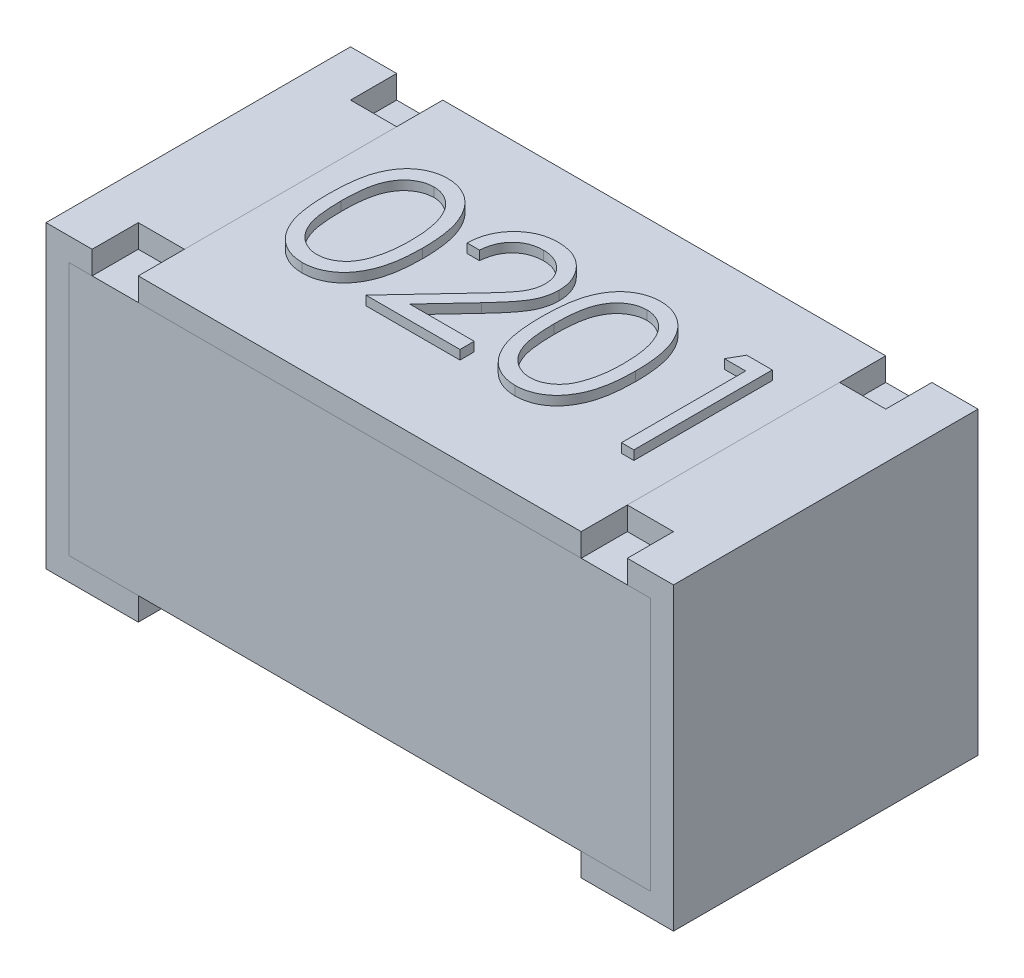
from build123d import *

# Parameters (mm, degrees)
CROQUIS1_W          = 0.63
CROQUIS1_H          = 0.33
EXTRUIR1_DEPTH      = 0.3
CROQUIS2_W          = 0.63
CROQUIS2_H          = 0.025
EXTRUIR2_DEPTH      = 1.546008242
CROQUIS4_W          = 0.33
CROQUIS4_H          = 0.025
EXTRUIR3_DEPTH      = 0.48
CROQUIS5_W          = 0.05
CROQUIS5_H          = 0.05
EXTRUIR4_DEPTH      = 0.025
BOSS_EXTRUDE1_DEPTH = 0.01


with BuildPart() as part:
    # Croquis1 → Extruir1 (new body)
    with BuildSketch(Plane(origin=(0, 0, 0), x_dir=(1, 0, 0), z_dir=(0, 1, 0))):
        Rectangle(CROQUIS1_W, CROQUIS1_H)
    extrude(amount=EXTRUIR1_DEPTH)

    # Croquis2 → Extruir2 (cut, through all)
    with BuildSketch(Plane.XY.offset(0.165)):
        with Locations((0, 0.0125)):
            Rectangle(CROQUIS2_W, CROQUIS2_H)
    extrude(amount=-EXTRUIR2_DEPTH, mode=Mode.SUBTRACT)


with BuildPart() as body_2:
    # Barrer1: sweep along a path in Croquis3
    with BuildLine(Plane.XY.offset(0.165)) as barrer1_path:
        Line((-0.24, 0.325), (-0.34, 0.325))
        Line((-0.34, 0.325), (-0.34, 0))
        Line((-0.34, 0), (-0.24, 0))
    # Croquis3D1 → Barrer1 (sweep)
    with BuildSketch(Plane(origin=(-0.24, 0.325, 0.165), x_dir=(0, -0.07554111272939004, -0.99714268802795), z_dir=(-1, 0, 0))):
        Polygon((0, 0), (0.329057087, -0.024928567), (0.330945615, 0), (0.001888528, 0.024928567), align=None)
    sweep(path=barrer1_path.line, transition=Transition.RIGHT)


with BuildPart() as body_3:
    # Simetría1: mirrored copy
    add(body_2.part.mirror(Plane(origin=(0, 0.3, 0.165), x_dir=(0, 0, 1), z_dir=(1, 0, 0))))


with BuildPart() as body_4:
    # Croquis4 → Extruir3 (new body)
    with BuildSketch(Plane(origin=(-0.24, 0, 0), x_dir=(0, 0, -1), z_dir=(1, 0, 0))):
        with Locations((0, 0.3125)):
            Rectangle(CROQUIS4_W, CROQUIS4_H)
    extrude(amount=EXTRUIR3_DEPTH)

    # Sketch1 → Boss-Extrude1 (add)
    # profile 1 of 4: a face of its own
    with BuildSketch(Plane(origin=(0, 0.325, 0), x_dir=(1, 0, 0), z_dir=(0, 1, 0))):
        with BuildLine():
            add(Edge.make_bspline(
                [(-0.203961996, 0.005221836), (-0.203947938, 0.007626009), (-0.20392063, 0.012296151), (-0.203616841, 0.019101208), (-0.203112183, 0.02548522), (-0.202420581, 0.031448494), (-0.201578954, 0.03699257), (-0.200455433, 0.042102631), (-0.199177741, 0.046802328), (-0.197696922, 0.051106987), (-0.196026017, 0.055074603), (-0.194207406, 0.058778541), (-0.192168915, 0.062213195), (-0.190027047, 0.065433386), (-0.187695101, 0.068386401), (-0.185239439, 0.071113944), (-0.182564215, 0.073552976), (-0.179760372, 0.07577496), (-0.176802524, 0.077722795), (-0.173774981, 0.079438484), (-0.170656905, 0.080904192), (-0.167439783, 0.08205664), (-0.16415253, 0.083008533), (-0.160783656, 0.083659488), (-0.157327597, 0.08406907), (-0.154994822, 0.084108227), (-0.153811755, 0.084128086)],
                knots=[0, 0, 0, 0, 1.646270934, 3.197905019, 4.663502075, 6.030701355, 7.308322542, 8.50163776, 9.611534131, 10.641858119, 11.616356847, 12.558055219, 13.465016945, 14.349605745, 15.204443733, 16.039544428, 16.859896111, 17.680448484, 18.487036065, 19.28249412, 20.06191084, 20.843045899, 21.620316918, 22.403196591, 23.190181807, 24, 24, 24, 24], degree=3))
            add(Edge.make_bspline(
                [(-0.153811755, 0.084128086), (-0.152618806, 0.084107179), (-0.150246406, 0.084065603), (-0.146738961, 0.083666005), (-0.143312546, 0.083002957), (-0.139981769, 0.082063487), (-0.13671927, 0.080897958), (-0.133550566, 0.079437081), (-0.130455977, 0.077736559), (-0.127484679, 0.075738392), (-0.124604053, 0.073510581), (-0.121884854, 0.070992181), (-0.119326836, 0.068208621), (-0.116897895, 0.065189684), (-0.114666941, 0.061877466), (-0.112542365, 0.058329576), (-0.110640706, 0.054483967), (-0.10880922, 0.050404804), (-0.107228349, 0.045979219), (-0.105802653, 0.041232158), (-0.104650697, 0.03610755), (-0.103691157, 0.030632282), (-0.102947804, 0.024786247), (-0.102406405, 0.018581976), (-0.102120416, 0.012015388), (-0.102066557, 0.007525766), (-0.102038919, 0.005221836)],
                knots=[0, 0, 0, 0, 0.810914788, 1.612654377, 2.396697861, 3.181598691, 3.963628158, 4.749916497, 5.551656086, 6.361998678, 7.18212741, 8.025565596, 8.878627764, 9.750805457, 10.657531673, 11.591944965, 12.560506719, 13.57287815, 14.630710178, 15.753379473, 16.941251878, 18.199788006, 19.531962791, 20.947069417, 22.433333509, 24, 24, 24, 24], degree=3))
            add(Edge.make_bspline(
                [(-0.102038919, 0.005221836), (-0.102066844, 0.002927954), (-0.102121255, -0.001541581), (-0.102403199, -0.008078623), (-0.102958569, -0.014249968), (-0.103653283, -0.020070416), (-0.104615467, -0.025515743), (-0.105798546, -0.030604791), (-0.107112131, -0.035359536), (-0.108733622, -0.039741028), (-0.110508367, -0.043810388), (-0.112439304, -0.047610409), (-0.114508011, -0.051174678), (-0.116761814, -0.054474667), (-0.119164103, -0.057533753), (-0.121766294, -0.060297937), (-0.124495033, -0.062833823), (-0.127384137, -0.065090321), (-0.130401775, -0.067065384), (-0.133485735, -0.068831692), (-0.136690737, -0.07025595), (-0.13994415, -0.07147888), (-0.143292508, -0.072413186), (-0.146731639, -0.073059208), (-0.150244049, -0.073512287), (-0.152618402, -0.073546851), (-0.153811755, -0.073564222)],
                knots=[0, 0, 0, 0, 1.561518951, 3.042555995, 4.452378317, 5.7783523, 7.031515105, 8.214008947, 9.334062868, 10.386615937, 11.391082383, 12.354592575, 13.286541444, 14.194233754, 15.072674879, 15.931287219, 16.775624067, 17.606195743, 18.42308326, 19.229000347, 20.022332153, 20.807536673, 21.593273796, 22.3848459, 23.188221202, 24, 24, 24, 24], degree=3))
            add(Edge.make_bspline(
                [(-0.153811755, -0.073564222), (-0.154994789, -0.073544236), (-0.1573275, -0.073504826), (-0.160784032, -0.073097094), (-0.164138994, -0.072441573), (-0.167408941, -0.071523718), (-0.170610649, -0.070400225), (-0.17370049, -0.068936496), (-0.176712819, -0.06725075), (-0.1796396, -0.065330946), (-0.182425835, -0.063131446), (-0.185087204, -0.060698691), (-0.187556848, -0.057971973), (-0.189855452, -0.054994348), (-0.192040056, -0.051793209), (-0.1940496, -0.04832485), (-0.195908351, -0.044603024), (-0.197607358, -0.040603685), (-0.199113729, -0.036268473), (-0.200444345, -0.031547794), (-0.201494952, -0.026399981), (-0.202394221, -0.02086638), (-0.203119552, -0.014923212), (-0.203614737, -0.00856725), (-0.203920794, -0.001802455), (-0.203948011, 0.002837678), (-0.203961996, 0.005221836)],
                knots=[0, 0, 0, 0, 0.810891512, 1.598919785, 2.382837074, 3.152667961, 3.926044502, 4.706494248, 5.493654104, 6.291793342, 7.103789334, 7.925228297, 8.761435821, 9.622817696, 10.50288917, 11.416980706, 12.369136599, 13.353924996, 14.394355917, 15.514179734, 16.714354668, 17.994756427, 19.357759367, 20.818452758, 22.365282078, 24, 24, 24, 24], degree=3))
        make_face()
        with BuildLine():
            add(Edge.make_bspline(
                [(-0.190500457, 0.005281932), (-0.190495338, 0.003278416), (-0.190485403, -0.000610015), (-0.190225851, -0.00626044), (-0.18987227, -0.011530597), (-0.189416214, -0.016427177), (-0.188738945, -0.020933606), (-0.187980083, -0.025080878), (-0.187056593, -0.028847046), (-0.18596395, -0.032257952), (-0.184719417, -0.035371483), (-0.183360594, -0.038268678), (-0.181900849, -0.040983761), (-0.180267171, -0.043492344), (-0.178487954, -0.045802609), (-0.176603386, -0.047955444), (-0.174543132, -0.049875315), (-0.171692972, -0.052177894), (-0.167930266, -0.054557286), (-0.163189389, -0.056629261), (-0.158317884, -0.057931366), (-0.155011402, -0.058096956), (-0.153361034, -0.058179607)],
                knots=[0, 0, 0, 0, 1.459021318, 2.831673884, 4.118529203, 5.306027144, 6.411944654, 7.436330062, 8.375795394, 9.233974572, 10.042671642, 10.816086306, 11.563610507, 12.285937304, 12.993564865, 13.685989202, 14.367179055, 15.041617293, 16.353048772, 17.594441528, 18.799311195, 20, 20, 20, 20], degree=3))
            add(Edge.make_bspline(
                [(-0.153361034, -0.058179607), (-0.151699991, -0.05811113), (-0.148381334, -0.057974319), (-0.143532743, -0.056654373), (-0.138825732, -0.054662822), (-0.135136934, -0.052307929), (-0.132330539, -0.050065286), (-0.130319811, -0.04815323), (-0.128474295, -0.046012264), (-0.12672392, -0.043702294), (-0.125118531, -0.041179187), (-0.123658683, -0.038455077), (-0.122326539, -0.035522398), (-0.12156758, -0.033475124), (-0.121179544, -0.032428405)],
                knots=[0, 0, 0, 0, 1.353760809, 2.704726607, 4.075137775, 5.516104923, 6.260822281, 7.007110065, 7.778089737, 8.566572457, 9.372053459, 10.217411131, 11.088608312, 12, 12, 12, 12], degree=3))
            add(Edge.make_bspline(
                [(-0.121179544, -0.032428405), (-0.120727325, -0.031089987), (-0.119809127, -0.028372426), (-0.118625766, -0.024156841), (-0.11769382, -0.019733865), (-0.11685539, -0.015129932), (-0.116283116, -0.010311088), (-0.115822496, -0.005292243), (-0.115551181, -6.9613e-05), (-0.115517548, 0.003478744), (-0.115500457, 0.005281932)],
                knots=[0, 0, 0, 0, 0.884706709, 1.796334032, 2.740027952, 3.714592787, 4.726048262, 5.777819803, 6.87074269, 8, 8, 8, 8], degree=3))
            add(Edge.make_bspline(
                [(-0.115500457, 0.005281932), (-0.115524037, 0.007084828), (-0.115570163, 0.010611678), (-0.115746477, 0.015776742), (-0.116201773, 0.020682504), (-0.11670745, 0.025350095), (-0.117453045, 0.02975368), (-0.118256951, 0.033930121), (-0.119337003, 0.03782768), (-0.120490708, 0.041507376), (-0.121811153, 0.044927404), (-0.123264685, 0.048103709), (-0.124817046, 0.051051626), (-0.126503142, 0.053763066), (-0.128302957, 0.056250175), (-0.130263994, 0.058463086), (-0.132308468, 0.060470385), (-0.135172061, 0.062761638), (-0.138920959, 0.065097854), (-0.143585773, 0.067247815), (-0.148440229, 0.068482456), (-0.151721949, 0.068656528), (-0.153361034, 0.06874347)],
                knots=[0, 0, 0, 0, 1.31362396, 2.569729283, 3.763502607, 4.902122613, 5.988968491, 7.01645872, 7.998833611, 8.933434873, 9.825090667, 10.667526885, 11.477055099, 12.250526234, 12.991942729, 13.710640831, 14.402115721, 15.076753259, 16.378508321, 17.609869233, 18.806226677, 20, 20, 20, 20], degree=3))
            add(Edge.make_bspline(
                [(-0.153361034, 0.06874347), (-0.15502006, 0.068656408), (-0.158341133, 0.068482126), (-0.163246045, 0.067252415), (-0.16794766, 0.065109002), (-0.171686645, 0.0627539), (-0.174552236, 0.06051083), (-0.176570065, 0.058565696), (-0.178462044, 0.056437999), (-0.180204946, 0.054106489), (-0.181837343, 0.05160083), (-0.18333653, 0.048901312), (-0.184687272, 0.045994253), (-0.185933752, 0.04288212), (-0.187029729, 0.039471508), (-0.187933756, 0.03570998), (-0.188768916, 0.031575899), (-0.189360141, 0.027045063), (-0.189885731, 0.022147256), (-0.190223503, 0.016863943), (-0.190486271, 0.011204041), (-0.190495634, 0.007295505), (-0.190500457, 0.005281932)],
                knots=[0, 0, 0, 0, 1.207732386, 2.417664972, 3.655092373, 4.956220595, 5.625982001, 6.301752483, 6.994047911, 7.697131622, 8.419323945, 9.170223765, 9.943494443, 10.752040957, 11.610060368, 12.549350801, 13.567764191, 14.679664412, 15.874934091, 17.154273443, 18.533957287, 20, 20, 20, 20], degree=3))
        make_face(mode=Mode.SUBTRACT)
    # profile 2 of 4: a face of its own
    with BuildSketch(Plane(origin=(0, 0.325, 0), x_dir=(1, 0, 0), z_dir=(0, 1, 0))):
        with BuildLine():
            Line((-0.069346611, 0.034128086), (-0.08280815, 0.034128086))
            add(Edge.make_bspline(
                [(-0.08280815, 0.034128086), (-0.082720414, 0.035913981), (-0.082548105, 0.039421431), (-0.081741178, 0.044535313), (-0.080586569, 0.049423376), (-0.078954078, 0.054046372), (-0.076926667, 0.058445178), (-0.07449538, 0.062602322), (-0.071615643, 0.066501944), (-0.06834964, 0.070107894), (-0.064802413, 0.073415933), (-0.060975015, 0.076272586), (-0.056953086, 0.078686201), (-0.052748826, 0.080703968), (-0.048314802, 0.082218533), (-0.043691251, 0.083342318), (-0.038857859, 0.084018447), (-0.035564715, 0.084091124), (-0.03388988, 0.084128086)],
                knots=[0, 0, 0, 0, 1.10065271, 2.161652631, 3.183658789, 4.190468796, 5.17591951, 6.163126047, 7.15150782, 8.156236427, 9.156009102, 10.134482811, 11.092018607, 12.041330605, 13.001268258, 13.972401359, 14.968799086, 16, 16, 16, 16], degree=3))
            add(Edge.make_bspline(
                [(-0.03388988, 0.084128086), (-0.032245106, 0.08408958), (-0.029013182, 0.084013919), (-0.024296239, 0.08336416), (-0.019805783, 0.082346492), (-0.015550593, 0.080918689), (-0.011564619, 0.078999356), (-0.007817917, 0.076693747), (-0.004265883, 0.074027183), (-0.001068449, 0.070887734), (0.001867612, 0.067536203), (0.004400565, 0.06395815), (0.006569701, 0.060262609), (0.008377744, 0.056421401), (0.009708722, 0.052398357), (0.010719216, 0.048252048), (0.011290391, 0.043939556), (0.011378052, 0.041020704), (0.01142262, 0.039536739)],
                knots=[0, 0, 0, 0, 1.111607364, 2.184268762, 3.212621178, 4.221274766, 5.211760367, 6.196651075, 7.1921475, 8.207485113, 9.220403448, 10.201281604, 11.166441695, 12.114753415, 13.065576456, 14.026450734, 14.996634279, 16, 16, 16, 16], degree=3))
            add(Edge.make_bspline(
                [(0.01142262, 0.039536739), (0.011350051, 0.037447546), (0.011206188, 0.033305823), (0.009975572, 0.027219472), (0.008053578, 0.021322611), (0.005739406, 0.016576727), (0.003404873, 0.012752434), (0.001301122, 0.009603775), (-0.001161655, 0.006213541), (-0.004019305, 0.002593083), (-0.007212714, -0.001285955), (-0.010770807, -0.005421232), (-0.014718956, -0.009770022), (-0.017490035, -0.012740262), (-0.018925938, -0.014279366)],
                knots=[0, 0, 0, 0, 1.184426356, 2.348067706, 3.509069118, 4.696110526, 5.333549288, 6.050745305, 6.844228056, 7.710549037, 8.667450064, 9.695053472, 10.805634456, 12, 12, 12, 12], degree=3))
            Line((-0.018925938, -0.014279366), (-0.056455986, -0.054333453))
            Line((-0.056455986, -0.054333453), (0.013345697, -0.054333453))
            Line((0.013345697, -0.054333453), (0.013345697, -0.069718068))
            Line((0.013345697, -0.069718068), (-0.08857738, -0.069718068))
            Line((-0.08857738, -0.069718068), (-0.030404303, -0.007638741))
            add(Edge.make_bspline(
                [(-0.030404303, -0.007638741), (-0.028987965, -0.006160243), (-0.02626747, -0.003320349), (-0.022419645, 0.000825778), (-0.018963689, 0.004672187), (-0.015877229, 0.00821161), (-0.013227222, 0.01149582), (-0.010875554, 0.014418451), (-0.008991315, 0.017107927), (-0.006946369, 0.020225382), (-0.00496577, 0.024031624), (-0.003263812, 0.028683068), (-0.002226033, 0.033471379), (-0.00210154, 0.03670718), (-0.002038919, 0.038334816)],
                knots=[0, 0, 0, 0, 1.329631726, 2.553950428, 3.673215718, 4.687767853, 5.603093632, 6.413772471, 7.123043292, 7.734684054, 8.834405432, 9.900288307, 10.943827018, 12, 12, 12, 12], degree=3))
            add(Edge.make_bspline(
                [(-0.002038919, 0.038334816), (-0.002066165, 0.039358305), (-0.002119862, 0.041375404), (-0.002593763, 0.044332794), (-0.003309928, 0.047185571), (-0.004336153, 0.049942512), (-0.005690728, 0.052575897), (-0.007339587, 0.055088932), (-0.009242018, 0.057518459), (-0.011442787, 0.059796458), (-0.013860423, 0.061882795), (-0.016414462, 0.06373097), (-0.01911661, 0.065275504), (-0.021955472, 0.066541653), (-0.024923135, 0.067534884), (-0.028025339, 0.068223109), (-0.031253511, 0.068655215), (-0.033457803, 0.06871368), (-0.034580986, 0.06874347)],
                knots=[0, 0, 0, 0, 0.991446411, 1.95395049, 2.89581595, 3.838931463, 4.798493298, 5.75982156, 6.748411868, 7.785213223, 8.824556874, 9.840280684, 10.836137867, 11.835679398, 12.848801643, 13.863922112, 14.911575587, 16, 16, 16, 16], degree=3))
            add(Edge.make_bspline(
                [(-0.034580986, 0.06874347), (-0.035754022, 0.068712826), (-0.03805767, 0.068652646), (-0.041439914, 0.068231674), (-0.044666448, 0.067505424), (-0.047745387, 0.066512138), (-0.05068194, 0.065249629), (-0.053461828, 0.063677125), (-0.056078809, 0.06180069), (-0.058537803, 0.059673238), (-0.060803402, 0.057304626), (-0.062793982, 0.054664199), (-0.064533297, 0.051800167), (-0.066050836, 0.048720258), (-0.067283222, 0.045396524), (-0.068224929, 0.041840765), (-0.068970079, 0.038068421), (-0.069219016, 0.035463346), (-0.069346611, 0.034128086)],
                knots=[0, 0, 0, 0, 1.031018746, 2.02475058, 2.990194455, 3.934040569, 4.864654155, 5.795059489, 6.735614925, 7.690564532, 8.649604399, 9.611025574, 10.590972636, 11.591080095, 12.624614302, 13.701020113, 14.821632451, 16, 16, 16, 16], degree=3))
        make_face()
    # profile 3 of 4: a face of its own
    with BuildSketch(Plane(origin=(0, 0.325, 0), x_dir=(1, 0, 0), z_dir=(0, 1, 0))):
        with BuildLine():
            add(Edge.make_bspline(
                [(0.026807235, 0.005221836), (0.026821293, 0.007626009), (0.026848601, 0.012296151), (0.02715239, 0.019101208), (0.027657048, 0.02548522), (0.028348649, 0.031448494), (0.029190277, 0.03699257), (0.030313798, 0.042102631), (0.031591489, 0.046802328), (0.033072309, 0.051106987), (0.034743214, 0.055074603), (0.036561825, 0.058778541), (0.038600316, 0.062213195), (0.040742184, 0.065433386), (0.04307413, 0.068386401), (0.045529792, 0.071113944), (0.048205016, 0.073552976), (0.051008859, 0.07577496), (0.053966707, 0.077722795), (0.05699425, 0.079438484), (0.060112326, 0.080904192), (0.063329448, 0.08205664), (0.066616701, 0.083008533), (0.069985575, 0.083659488), (0.073441633, 0.08406907), (0.075774409, 0.084108227), (0.076957475, 0.084128086)],
                knots=[0, 0, 0, 0, 1.646270934, 3.197905019, 4.663502075, 6.030701355, 7.308322542, 8.50163776, 9.611534131, 10.641858119, 11.616356847, 12.558055219, 13.465016945, 14.349605745, 15.204443733, 16.039544428, 16.859896111, 17.680448484, 18.487036065, 19.28249412, 20.06191084, 20.843045899, 21.620316918, 22.403196591, 23.190181807, 24, 24, 24, 24], degree=3))
            add(Edge.make_bspline(
                [(0.076957475, 0.084128086), (0.078150424, 0.084107179), (0.080522825, 0.084065603), (0.08403027, 0.083666005), (0.087456684, 0.083002957), (0.090787462, 0.082063487), (0.094049961, 0.080897958), (0.097218664, 0.079437081), (0.100313254, 0.077736559), (0.103284552, 0.075738392), (0.106165178, 0.073510581), (0.108884376, 0.070992181), (0.111442394, 0.068208621), (0.113871336, 0.065189684), (0.11610229, 0.061877466), (0.118226866, 0.058329576), (0.120128525, 0.054483967), (0.121960011, 0.050404804), (0.123540882, 0.045979219), (0.124966578, 0.041232158), (0.126118534, 0.03610755), (0.127078074, 0.030632282), (0.127821426, 0.024786247), (0.128362825, 0.018581976), (0.128648815, 0.012015388), (0.128702673, 0.007525766), (0.128730312, 0.005221836)],
                knots=[0, 0, 0, 0, 0.810914788, 1.612654377, 2.396697861, 3.181598691, 3.963628158, 4.749916497, 5.551656086, 6.361998678, 7.18212741, 8.025565596, 8.878627764, 9.750805457, 10.657531673, 11.591944965, 12.560506719, 13.57287815, 14.630710178, 15.753379473, 16.941251878, 18.199788006, 19.531962791, 20.947069417, 22.433333509, 24, 24, 24, 24], degree=3))
            add(Edge.make_bspline(
                [(0.128730312, 0.005221836), (0.128702387, 0.002927954), (0.128647976, -0.001541581), (0.128366031, -0.008078623), (0.127810662, -0.014249968), (0.127115948, -0.020070416), (0.126153764, -0.025515743), (0.124970685, -0.030604791), (0.1236571, -0.035359536), (0.122035609, -0.039741028), (0.120260864, -0.043810388), (0.118329927, -0.047610409), (0.11626122, -0.051174678), (0.114007417, -0.054474667), (0.111605128, -0.057533753), (0.109002937, -0.060297937), (0.106274197, -0.062833823), (0.103385094, -0.065090321), (0.100367456, -0.067065384), (0.097283495, -0.068831692), (0.094078493, -0.07025595), (0.090825081, -0.07147888), (0.087476723, -0.072413186), (0.084037591, -0.073059208), (0.080525181, -0.073512287), (0.078150829, -0.073546851), (0.076957475, -0.073564222)],
                knots=[0, 0, 0, 0, 1.561518951, 3.042555995, 4.452378317, 5.7783523, 7.031515105, 8.214008947, 9.334062868, 10.386615937, 11.391082383, 12.354592575, 13.286541444, 14.194233754, 15.072674879, 15.931287219, 16.775624067, 17.606195743, 18.42308326, 19.229000347, 20.022332153, 20.807536673, 21.593273796, 22.3848459, 23.188221202, 24, 24, 24, 24], degree=3))
            add(Edge.make_bspline(
                [(0.076957475, -0.073564222), (0.075774442, -0.073544236), (0.073441731, -0.073504826), (0.069985198, -0.073097094), (0.066630237, -0.072441573), (0.06336029, -0.071523718), (0.060158582, -0.070400225), (0.057068741, -0.068936496), (0.054056412, -0.06725075), (0.051129631, -0.065330946), (0.048343396, -0.063131446), (0.045682027, -0.060698691), (0.043212383, -0.057971973), (0.040913779, -0.054994348), (0.038729175, -0.051793209), (0.036719631, -0.04832485), (0.03486088, -0.044603024), (0.033161873, -0.040603685), (0.031655502, -0.036268473), (0.030324886, -0.031547794), (0.029274279, -0.026399981), (0.028375009, -0.02086638), (0.027649679, -0.014923212), (0.027154493, -0.00856725), (0.026848437, -0.001802455), (0.02682122, 0.002837678), (0.026807235, 0.005221836)],
                knots=[0, 0, 0, 0, 0.810891512, 1.598919785, 2.382837074, 3.152667961, 3.926044502, 4.706494248, 5.493654104, 6.291793342, 7.103789334, 7.925228297, 8.761435821, 9.622817696, 10.50288917, 11.416980706, 12.369136599, 13.353924996, 14.394355917, 15.514179734, 16.714354668, 17.994756427, 19.357759367, 20.818452758, 22.365282078, 24, 24, 24, 24], degree=3))
        make_face()
        with BuildLine():
            add(Edge.make_bspline(
                [(0.040268773, 0.005281932), (0.040273893, 0.003278416), (0.040283828, -0.000610015), (0.040543379, -0.00626044), (0.040896961, -0.011530597), (0.041353016, -0.016427177), (0.042030286, -0.020933606), (0.042789148, -0.025080878), (0.043712637, -0.028847046), (0.044805281, -0.032257952), (0.046049814, -0.035371483), (0.047408637, -0.038268678), (0.048868382, -0.040983761), (0.05050206, -0.043492344), (0.052281277, -0.045802609), (0.054165845, -0.047955444), (0.056226099, -0.049875315), (0.059076259, -0.052177894), (0.062838965, -0.054557286), (0.067579842, -0.056629261), (0.072451347, -0.057931366), (0.075757829, -0.058096956), (0.077408197, -0.058179607)],
                knots=[0, 0, 0, 0, 1.459021318, 2.831673884, 4.118529203, 5.306027144, 6.411944654, 7.436330062, 8.375795394, 9.233974572, 10.042671642, 10.816086306, 11.563610507, 12.285937304, 12.993564865, 13.685989202, 14.367179055, 15.041617293, 16.353048772, 17.594441528, 18.799311195, 20, 20, 20, 20], degree=3))
            add(Edge.make_bspline(
                [(0.077408197, -0.058179607), (0.07906924, -0.05811113), (0.082387896, -0.057974319), (0.087236488, -0.056654373), (0.091943499, -0.054662822), (0.095632297, -0.052307929), (0.098438691, -0.050065286), (0.100449419, -0.04815323), (0.102294936, -0.046012264), (0.10404531, -0.043702294), (0.105650699, -0.041179187), (0.107110548, -0.038455077), (0.108442692, -0.035522398), (0.109201651, -0.033475124), (0.109589687, -0.032428405)],
                knots=[0, 0, 0, 0, 1.353760809, 2.704726607, 4.075137775, 5.516104923, 6.260822281, 7.007110065, 7.778089737, 8.566572457, 9.372053459, 10.217411131, 11.088608312, 12, 12, 12, 12], degree=3))
            add(Edge.make_bspline(
                [(0.109589687, -0.032428405), (0.110041906, -0.031089987), (0.110960103, -0.028372426), (0.112143465, -0.024156841), (0.113075411, -0.019733865), (0.113913841, -0.015129932), (0.114486115, -0.010311088), (0.114946735, -0.005292243), (0.11521805, -6.9613e-05), (0.115251682, 0.003478744), (0.115268773, 0.005281932)],
                knots=[0, 0, 0, 0, 0.884706709, 1.796334032, 2.740027952, 3.714592787, 4.726048262, 5.777819803, 6.87074269, 8, 8, 8, 8], degree=3))
            add(Edge.make_bspline(
                [(0.115268773, 0.005281932), (0.115245194, 0.007084828), (0.115199067, 0.010611678), (0.115022754, 0.015776742), (0.114567458, 0.020682504), (0.114061781, 0.025350095), (0.113316186, 0.02975368), (0.11251228, 0.033930121), (0.111432228, 0.03782768), (0.110278523, 0.041507376), (0.108958078, 0.044927404), (0.107504546, 0.048103709), (0.105952185, 0.051051626), (0.104266089, 0.053763066), (0.102466274, 0.056250175), (0.100505236, 0.058463086), (0.098460763, 0.060470385), (0.095597169, 0.062761638), (0.091848271, 0.065097854), (0.087183458, 0.067247815), (0.082329002, 0.068482456), (0.079047282, 0.068656528), (0.077408197, 0.06874347)],
                knots=[0, 0, 0, 0, 1.31362396, 2.569729283, 3.763502607, 4.902122613, 5.988968491, 7.01645872, 7.998833611, 8.933434873, 9.825090667, 10.667526885, 11.477055099, 12.250526234, 12.991942729, 13.710640831, 14.402115721, 15.076753259, 16.378508321, 17.609869233, 18.806226677, 20, 20, 20, 20], degree=3))
            add(Edge.make_bspline(
                [(0.077408197, 0.06874347), (0.075749171, 0.068656408), (0.072428098, 0.068482126), (0.067523186, 0.067252415), (0.062821571, 0.065109002), (0.059082586, 0.0627539), (0.056216995, 0.06051083), (0.054199165, 0.058565696), (0.052307187, 0.056437999), (0.050564285, 0.054106489), (0.048931887, 0.05160083), (0.047432701, 0.048901312), (0.046081958, 0.045994253), (0.044835478, 0.04288212), (0.043739502, 0.039471508), (0.042835475, 0.03570998), (0.042000315, 0.031575899), (0.041409089, 0.027045063), (0.0408835, 0.022147256), (0.040545728, 0.016863943), (0.04028296, 0.011204041), (0.040273597, 0.007295505), (0.040268773, 0.005281932)],
                knots=[0, 0, 0, 0, 1.207732386, 2.417664972, 3.655092373, 4.956220595, 5.625982001, 6.301752483, 6.994047911, 7.697131622, 8.419323945, 9.170223765, 9.943494443, 10.752040957, 11.610060368, 12.549350801, 13.567764191, 14.679664412, 15.874934091, 17.154273443, 18.533957287, 20, 20, 20, 20], degree=3))
        make_face(mode=Mode.SUBTRACT)
    # profile 4 of 4: a face of its own
    with BuildSketch(Plane(origin=(0, 0.325, 0), x_dir=(1, 0, 0), z_dir=(0, 1, 0))):
        Polygon((0.17407286, 0.080281932), (0.201807235, 0.080281932), (0.201807235, -0.069718068), (0.188345697, -0.069718068), (0.188345697, 0.064897316), (0.165268773, 0.064897316), align=None)
    extrude(amount=BOSS_EXTRUDE1_DEPTH)


with BuildPart() as extruir4_tool:
    # Croquis5 → Extruir4 (new body)
    with BuildSketch(Plane(origin=(0, 0.325, 0), x_dir=(1, 0, 0), z_dir=(0, 1, 0))):
        with Locations((-0.265, -0.14)):
            Rectangle(CROQUIS5_W, CROQUIS5_H)
        with Locations((-0.265, 0.14)):
            Rectangle(CROQUIS5_W, CROQUIS5_H)
        with Locations((0.265, 0.14)):
            Rectangle(CROQUIS5_W, CROQUIS5_H)
        with Locations((0.265, -0.14)):
            Rectangle(CROQUIS5_W, CROQUIS5_H)
    extrude(amount=-EXTRUIR4_DEPTH)


with BuildPart() as body_2_1:
    add(body_2.part)

    # Extruir4: cut by extruir4_tool
    add(extruir4_tool.part, mode=Mode.SUBTRACT)


with BuildPart() as body_3_1:
    add(body_3.part)

    # Extruir4: cut by extruir4_tool
    add(extruir4_tool.part, mode=Mode.SUBTRACT)


solid = Compound([part.part, body_4.part, body_2_1.part, body_3_1.part])
